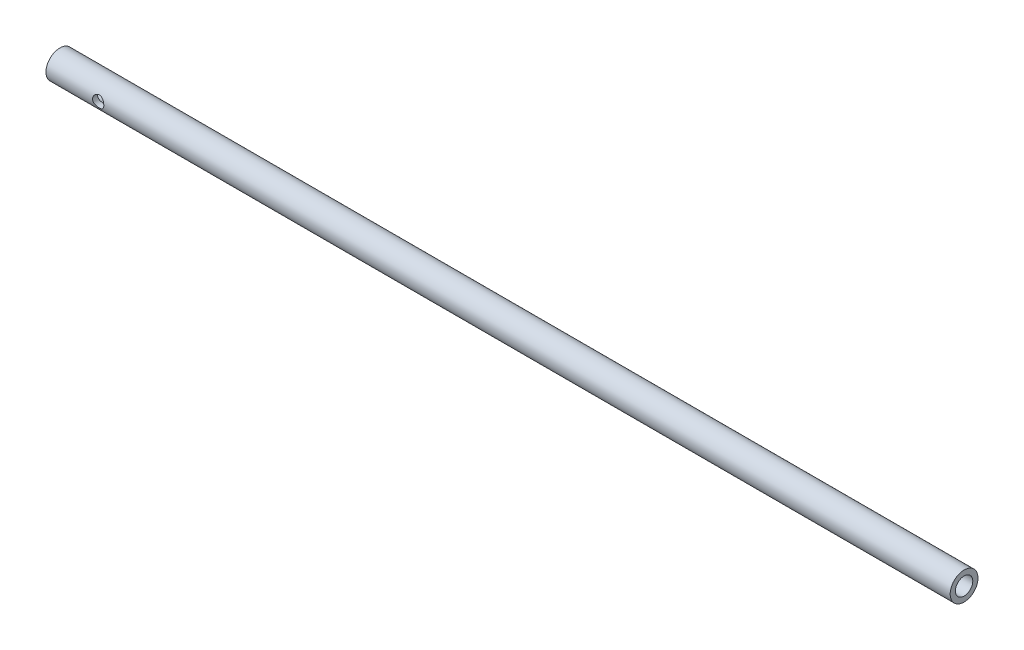
from build123d import *

# Parameters (mm, degrees)
SKETCH1_R           = 16
SKETCH1_R_2         = 10
BOSS_EXTRUDE1_DEPTH = 1040
SKETCH2_R           = 6.5
CUT_EXTRUDE1_DEPTH  = 29.5


with BuildPart() as part:
    # Sketch1 → Boss-Extrude1 (new body)
    with BuildSketch(Plane(origin=(0, 0, 0), x_dir=(0, 0, -1), z_dir=(1, 0, 0))):
        Circle(SKETCH1_R)
        Circle(SKETCH1_R_2, mode=Mode.SUBTRACT)
    extrude(amount=-BOSS_EXTRUDE1_DEPTH)

    # Sketch2 → Cut-Extrude1 (cut, symmetric)
    with BuildSketch(Plane.XY):
        with Locations((-980, 0)):
            Circle(SKETCH2_R)
    extrude(amount=CUT_EXTRUDE1_DEPTH, both=True, mode=Mode.SUBTRACT)


solid = part.part
